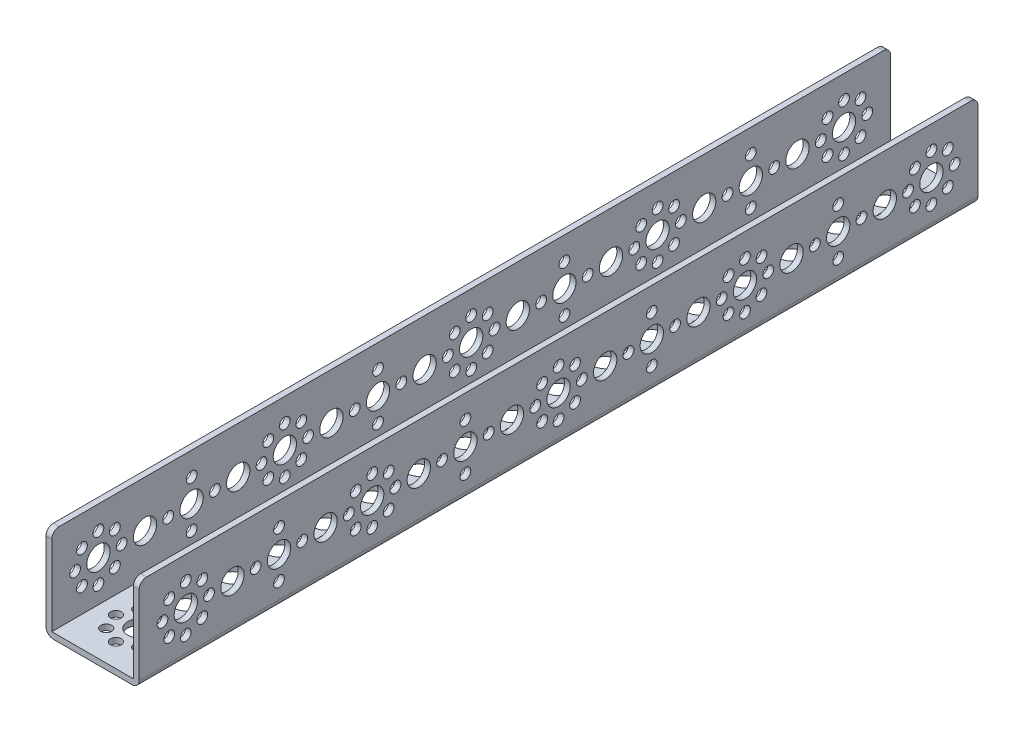
from build123d import *

# Parameters (mm, degrees)
SKETCH1_W                      = 288
SKETCH1_H                      = 32
BOSS_EXTRUDE1_DEPTH            = 32
SKETCH2_W                      = 28
SKETCH2_H                      = 30
CUT_EXTRUDE1_DEPTH             = 291.213714355
F_8_0_8_DIAMETER_HOLE1_D       = 8
F_8_0_8_DIAMETER_HOLE1_DEPTH   = 2
F_3_7_3_7_DIAMETER_HOLE1_D     = 3.7
F_3_7_3_7_DIAMETER_HOLE1_DEPTH = 2
F_3_7_3_7_DIAMETER_HOLE2_D     = 3.7
F_3_7_3_7_DIAMETER_HOLE2_DEPTH = 32
F_8_0_8_DIAMETER_HOLE2_D       = 8
F_8_0_8_DIAMETER_HOLE2_DEPTH   = 32
F_8_0_8_DIAMETER_HOLE3_D       = 8
F_8_0_8_DIAMETER_HOLE4_D       = 8
F_8_0_8_DIAMETER_HOLE4_DEPTH   = 32
F_3_7_3_7_DIAMETER_HOLE3_D     = 3.7
F_3_7_3_7_DIAMETER_HOLE3_DEPTH = 32
FILLET1_R                      = 2.5


with BuildPart() as part:
    # Sketch1 → Boss-Extrude1 (new body)
    with BuildSketch(Plane(origin=(16, 0, 0), x_dir=(0, 0, -1), z_dir=(1, 0, 0))):
        with Locations((128, 16)):
            Rectangle(SKETCH1_W, SKETCH1_H)
    extrude(amount=-BOSS_EXTRUDE1_DEPTH)

    # Sketch2 → Cut-Extrude1 (cut, through all)
    with BuildSketch(Plane(origin=(0, 0, -272), x_dir=(-1, 0, 0), z_dir=(0, 0, -1))):
        with Locations((0, 17)):
            Rectangle(SKETCH2_W, SKETCH2_H)
    extrude(amount=-CUT_EXTRUDE1_DEPTH, mode=Mode.SUBTRACT)

    # Ø8.0 (8) Diameter Hole1
    with Locations(Plane.ZY.offset(16)):
        with Locations((-64, 16), (-128, 16), (-192, 16), (-256, 16), (-32, 16), (-96, 16), (-160, 16), (-224, 16), (-16, 16), (-48, 16), (-80, 16), (-112, 16), (0, 16), (-144, 16), (-176, 16), (-208, 16), (-240, 16)):
            Hole(F_8_0_8_DIAMETER_HOLE1_D / 2, depth=F_8_0_8_DIAMETER_HOLE1_DEPTH)

    # Ø3.7 (3.7) Diameter Hole1
    with Locations(Plane.ZY.offset(16)):
        with Locations((0, 24), (0, 8), (-8, 16), (8, 16), (-5.656854249, 21.656854249), (5.656854249, 21.656854249), (5.656854249, 10.343145751), (-5.656854249, 10.343145751), (-64, 24), (-64, 8), (-72, 16), (-56, 16), (-69.656854249, 21.656854249), (-58.343145751, 21.656854249), (-58.343145751, 10.343145751), (-69.656854249, 10.343145751), (-128, 24), (-128, 8), (-136, 16), (-120, 16), (-133.656854249, 21.656854249), (-122.34314575, 21.656854249), (-122.34314575, 10.343145751), (-133.656854249, 10.343145751), (-192, 24), (-192, 8), (-200, 16), (-184, 16), (-197.656854249, 21.656854249), (-186.343145751, 21.656854249), (-186.343145751, 10.343145751), (-197.656854249, 10.343145751), (-256, 24), (-256, 8), (-264, 16), (-248, 16), (-261.656854249, 21.656854249), (-250.343145751, 21.656854249), (-250.343145751, 10.343145751), (-261.656854249, 10.343145751), (-32, 24), (-40, 16), (-32, 8), (-24, 16), (-96, 24), (-104, 16), (-96, 8), (-88, 16), (-160, 24), (-168, 16), (-160, 8), (-152, 16), (-224, 24), (-232, 16), (-224, 8), (-216, 16)):
            Hole(F_3_7_3_7_DIAMETER_HOLE1_D / 2, depth=F_3_7_3_7_DIAMETER_HOLE1_DEPTH)

    # Ø3.7 (3.7) Diameter Hole2
    with Locations(Plane(origin=(0, 0, 0), x_dir=(-1, 0, 0), z_dir=(0, -1, 0))):
        with Locations((8, 0), (5.656854249, 5.656854249), (0, 8), (-5.656854249, 5.656854249), (-8, 0), (-5.656854249, -5.656854249), (0, -8), (5.656854249, -5.656854249), (8, 64), (5.656854249, 69.656854249), (0, 72), (-5.656854249, 69.656854249), (-8, 64), (-5.656854249, 58.343145751), (0, 56), (5.656854249, 58.343145751), (8, 128), (5.656854249, 133.656854249), (0, 136), (-5.656854249, 133.656854249), (-8, 128), (-5.656854249, 122.34314575), (0, 120), (5.656854249, 122.34314575), (8, 192), (5.656854249, 197.656854249), (0, 200), (-5.656854249, 197.656854249), (-8, 192), (-5.656854249, 186.343145751), (0, 184), (5.656854249, 186.343145751), (8, 256), (5.656854249, 261.656854249), (0, 264), (-5.656854249, 261.656854249), (-8, 256), (-5.656854249, 250.343145751), (0, 248), (5.656854249, 250.343145751), (8, 32), (0, 40), (-8, 32), (0, 24), (8, 96), (0, 104), (-8, 96), (0, 88), (8, 160), (0, 168), (-8, 160), (0, 152), (8, 224), (0, 232), (-8, 224), (0, 216)):
            Hole(F_3_7_3_7_DIAMETER_HOLE2_D / 2, depth=F_3_7_3_7_DIAMETER_HOLE2_DEPTH)

    # Ø8.0 (8) Diameter Hole2
    with Locations(Plane(origin=(0, 0, 0), x_dir=(-1, 0, 0), z_dir=(0, -1, 0))):
        with Locations((0, 0), (0, 64), (0, 128), (0, 192), (0, 256), (0, 32), (0, 96), (0, 160), (0, 224), (0, 16), (0, 48), (0, 80), (0, 112), (0, 144), (0, 176), (0, 208), (0, 240)):
            Hole(F_8_0_8_DIAMETER_HOLE2_D / 2, depth=F_8_0_8_DIAMETER_HOLE2_DEPTH)

    # Ø8.0 (8) Diameter Hole3 (through all)
    with Locations(Plane.ZY.offset(-14)):
        with Locations((-32, 16)):
            Hole(F_8_0_8_DIAMETER_HOLE3_D / 2)

    # Ø8.0 (8) Diameter Hole4
    with Locations(Plane(origin=(16, 0, 0), x_dir=(0, 0, -1), z_dir=(1, 0, 0))):
        with Locations((64, 16), (128, 16), (192, 16), (256, 16), (96, 16), (160, 16), (224, 16), (16, 16), (48, 16), (80, 16), (112, 16), (0, 16), (144, 16), (176, 16), (208, 16), (240, 16)):
            Hole(F_8_0_8_DIAMETER_HOLE4_D / 2, depth=F_8_0_8_DIAMETER_HOLE4_DEPTH)

    # Ø3.7 (3.7) Diameter Hole3
    with Locations(Plane(origin=(16, 0, 0), x_dir=(0, 0, -1), z_dir=(1, 0, 0))):
        with Locations((0, 24), (0, 8), (8, 16), (-8, 16), (5.656854249, 21.656854249), (-5.656854249, 21.656854249), (-5.656854249, 10.343145751), (5.656854249, 10.343145751), (64, 24), (64, 8), (72, 16), (56, 16), (69.656854249, 21.656854249), (58.343145751, 21.656854249), (58.343145751, 10.343145751), (69.656854249, 10.343145751), (128, 24), (128, 8), (136, 16), (120, 16), (133.656854249, 21.656854249), (122.34314575, 21.656854249), (122.34314575, 10.343145751), (133.656854249, 10.343145751), (192, 24), (192, 8), (200, 16), (184, 16), (197.656854249, 21.656854249), (186.343145751, 21.656854249), (186.343145751, 10.343145751), (197.656854249, 10.343145751), (256, 24), (256, 8), (264, 16), (248, 16), (261.656854249, 21.656854249), (250.343145751, 21.656854249), (250.343145751, 10.343145751), (261.656854249, 10.343145751), (32, 24), (40, 16), (32, 8), (24, 16), (96, 24), (104, 16), (96, 8), (88, 16), (160, 24), (168, 16), (160, 8), (152, 16), (224, 24), (232, 16), (224, 8), (216, 16)):
            Hole(F_3_7_3_7_DIAMETER_HOLE3_D / 2, depth=F_3_7_3_7_DIAMETER_HOLE3_DEPTH)

    # Fillet1
    fillet1_edges = [part.edges().sort_by_distance(p)[0] for p in [
        (-16, 0, -128),
        (15, 32, 16),
        (15, 32, -272),
        (16, 0, -128),
        (-15, 32, -272),
        (-15, 32, 16),
    ]]
    fillet(fillet1_edges, radius=FILLET1_R)


solid = part.part
